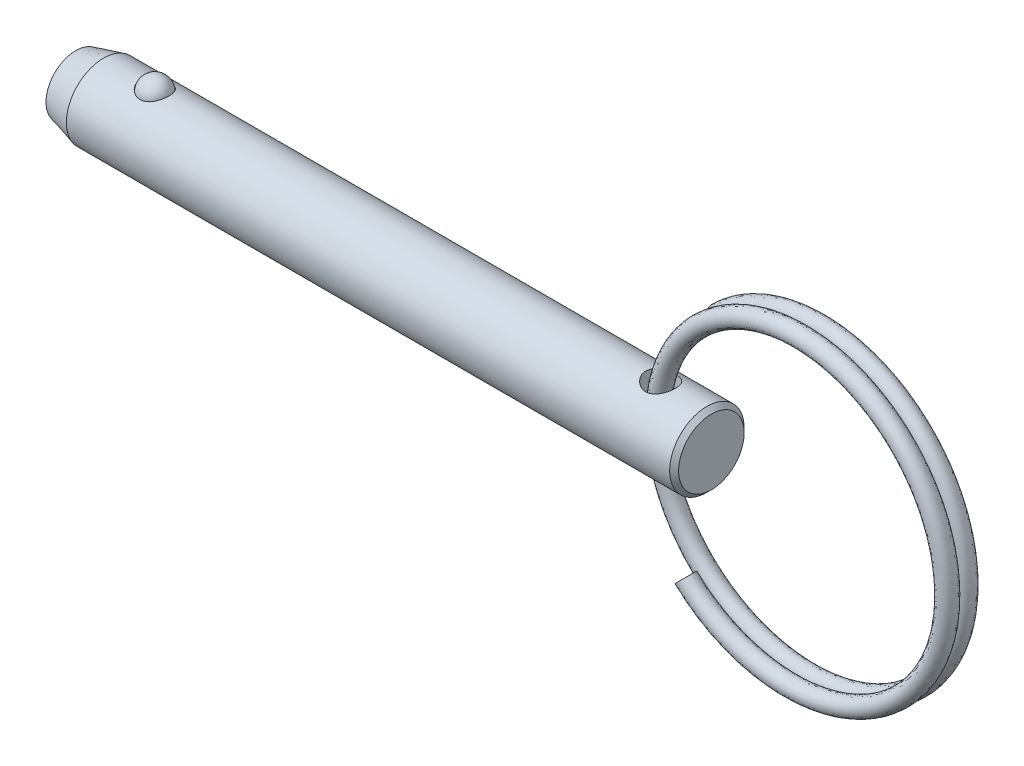
from build123d import *

# Parameters (mm, degrees)
SKETCH4_W          = 1.27
SKETCH4_H          = 6.35
SWEEP1_PITCH       = 1.5494
SWEEP1_HEIGHT      = 1.355725
SWEEP1_RADIUS      = 13.462
SKETCH6_R          = 0.762
SWEEP2_PITCH       = 1.5494
SWEEP2_HEIGHT      = 1.355725
SWEEP2_RADIUS      = 13.462
SWEEP2_START_ANGLE = -180
SKETCH6_2_R        = 0.762


with BuildPart() as part:
    # Sketch1 → Revolve1 (revolve)
    with BuildSketch(Plane.XY, mode=Mode.PRIVATE) as revolve1_sk:
        Polygon((27.0764, 2.794), (26.6954, 3.175), (-24.706547737, 3.175), (-27.0764, 2.54), (-27.0764, 0), (27.0764, 0), align=None)
    revolve(revolve1_sk.sketch.rotate(Axis((27.0764, 0, 0), (1, 0, 0)), 90), axis=Axis((27.0764, 0, 0), (1, 0, 0)))

    # Sketch2 → Cut-Revolve1 (revolve, cut)
    with BuildSketch(Plane.XY):
        with BuildLine():
            Line((-19.084582051, 2.8575), (-21.599182051, 2.8575))
            ThreePointArc((-21.599182051, 2.8575), (-20.341882051, 4.1148), (-19.084582051, 2.8575))
        make_face()
    revolve(axis=Axis((-19.084582051, 2.8575, 0), (1, 0, 0)), mode=Mode.SUBTRACT)

    # Sketch4 → Cut-Revolve2 (revolve, cut)
    with BuildSketch(Plane.XY, mode=Mode.PRIVATE) as cut_revolve2_sk:
        with Locations((23.3934, 0)):
            Rectangle(SKETCH4_W, SKETCH4_H)
    revolve(cut_revolve2_sk.sketch.rotate(Axis((22.7584, -3.175, 0), (0, 1, 0)), 90), axis=Axis((22.7584, -3.175, 0), (0, 1, 0)), mode=Mode.SUBTRACT)


with BuildPart() as body_2:
    # Sketch3 → Revolve2 (revolve)
    with BuildSketch(Plane.XY):
        with BuildLine():
            Line((-19.109982051, 2.8575), (-21.573782051, 2.8575))
            ThreePointArc((-21.573782051, 2.8575), (-20.341882051, 4.0894), (-19.109982051, 2.8575))
        make_face()
    revolve(axis=Axis((-19.109982051, 2.8575, 0), (1, 0, 0)))


with BuildPart() as body_3:
    # Sweep1: sweep along a helix
    with BuildLine() as sweep1_path:
        Helix(SWEEP1_PITCH, SWEEP1_HEIGHT, SWEEP1_RADIUS, center=(35.243425091, 0, 0), direction=(0, 0, -1), lefthand=True)
    # Sketch6 → Sweep1 (sweep)
    with BuildSketch(Plane(origin=(114.003847968, 0, 0), x_dir=(0, 0, -1), z_dir=(0, 1, 0))):
        with Locations((0, 91.460422877)):
            Circle(SKETCH6_R)
    sweep(path=sweep1_path.line, is_frenet=True)

    # Sweep2: sweep along a helix
    with BuildLine() as sweep2_path:
        add(Helix(SWEEP2_PITCH, SWEEP2_HEIGHT, SWEEP2_RADIUS, center=(35.243425091, 0, 0), direction=(0, 0, 1), lefthand=True, mode=Mode.PRIVATE).rotate(Axis((35.243425091, 0, 0), (0, 0, 1)), SWEEP2_START_ANGLE))
    # Sketch6<2> → Sweep2 (sweep)
    with BuildSketch(Plane(origin=(114.003847968, 0, 0), x_dir=(0, 0, -1), z_dir=(0, 1, 0))):
        with Locations((0, 91.460422877)):
            Circle(SKETCH6_2_R)
    sweep(path=sweep2_path.line, is_frenet=True)


solid = Compound([part.part, body_2.part, body_3.part])
